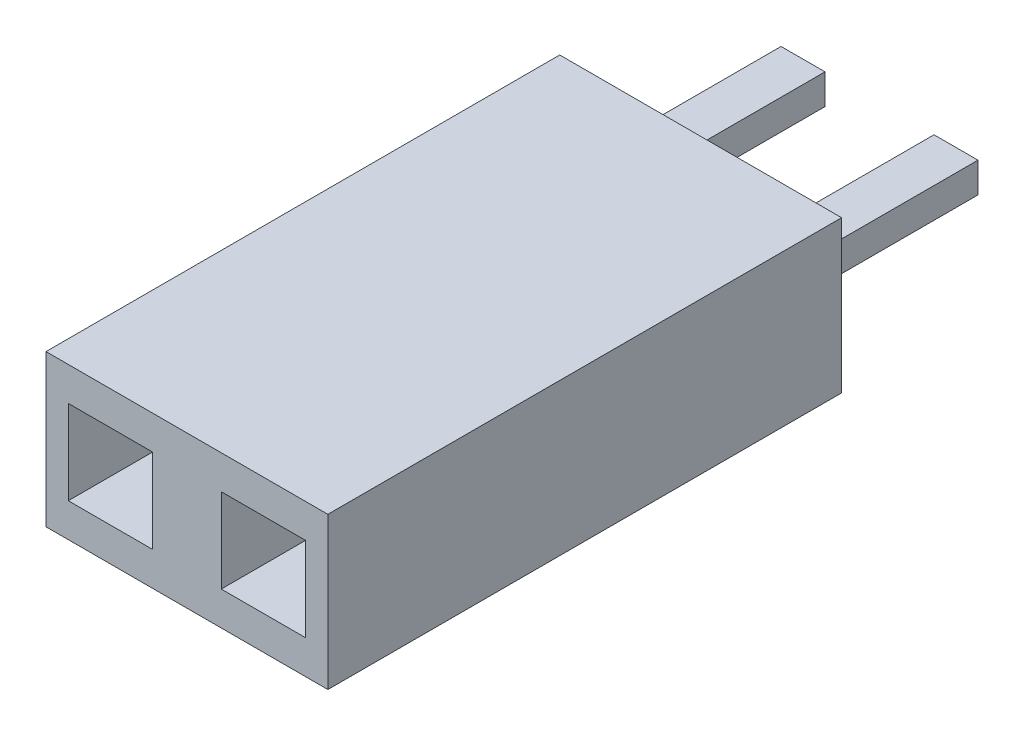
from build123d import *

# Parameters (mm, degrees)
SKETCH1_W               = 4.68
SKETCH1_H               = 2.52
COMPONENT_OUTLINE_DEPTH = 8.53
SKETCH2_W               = 1.4
SKETCH2_H               = 1.4
CUT_EXTRUDE1_DEPTH      = 8
LPATTERN1_COUNT         = 2
LPATTERN1_PITCH         = 2.54
SKETCH3_W               = 0.73
SKETCH3_H               = 0.5
BOSS_EXTRUDE1_DEPTH     = 3.5
LPATTERN2_COUNT         = 2
LPATTERN2_PITCH         = 2.54


with BuildPart() as part:
    # Sketch1 → Component_Outline (new body)
    with BuildSketch(Plane.XY):
        with Locations((-3.009528536, -0.057617866)):
            Rectangle(SKETCH1_W, SKETCH1_H)
    extrude(amount=COMPONENT_OUTLINE_DEPTH)

    # Sketch2 → Cut-Extrude1 (cut)
    with BuildSketch(Plane.XY.offset(8.53)):
        with Locations((-1.739528536, -0.057617866)):
            Rectangle(SKETCH2_W, SKETCH2_H)
    cut_extrude1 = extrude(amount=-CUT_EXTRUDE1_DEPTH, mode=Mode.SUBTRACT)

    # LPattern1: Cut-Extrude1 ×2
    with Locations(*[(-i * LPATTERN1_PITCH, 0, 0) for i in range(1, LPATTERN1_COUNT)]):
        add(cut_extrude1, mode=Mode.SUBTRACT)

    # Sketch3 → Boss-Extrude1 (add)
    with BuildSketch(Plane.XY.offset(0.53)):
        with Locations((-1.739528536, -0.057617866)):
            Rectangle(SKETCH3_W, SKETCH3_H)
    boss_extrude1 = extrude(amount=-BOSS_EXTRUDE1_DEPTH)

    # LPattern2: Boss-Extrude1 ×2
    with Locations(*[(-i * LPATTERN2_PITCH, 0, 0) for i in range(1, LPATTERN2_COUNT)]):
        add(boss_extrude1)


solid = part.part
